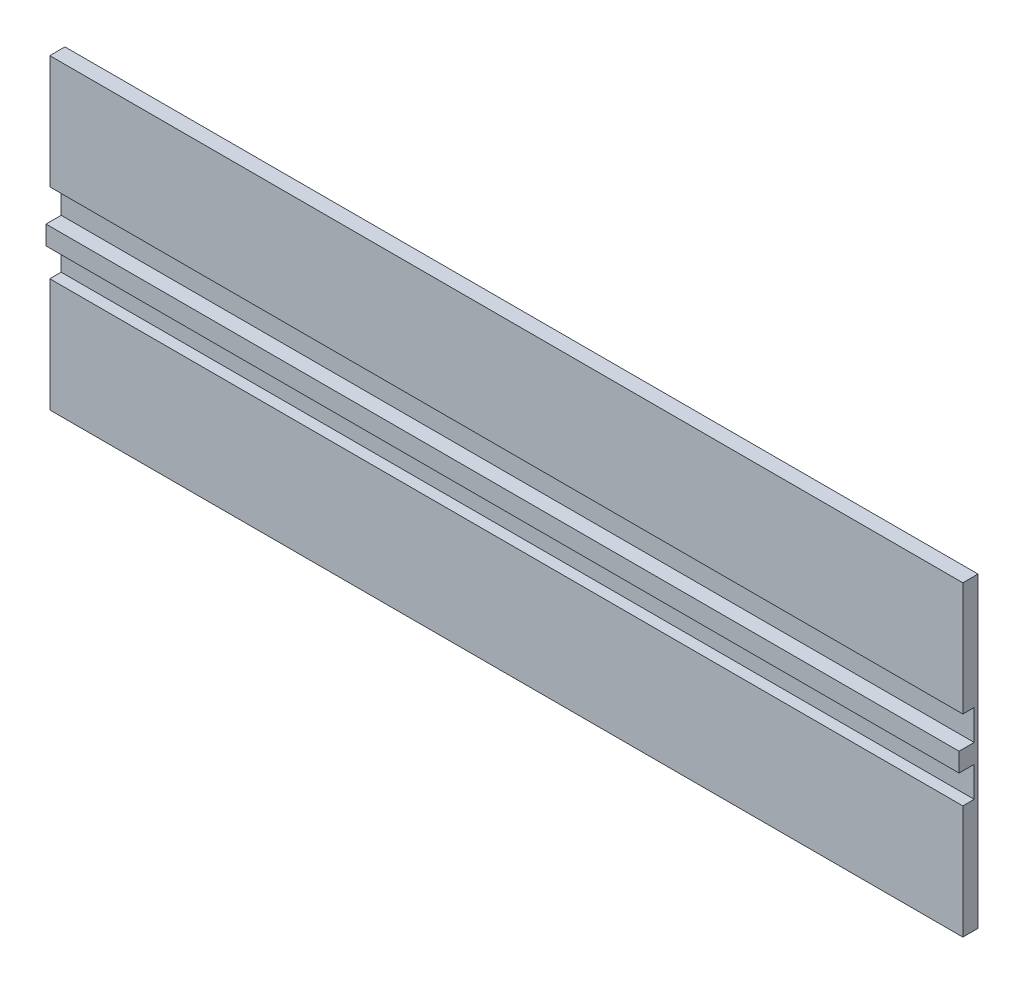
from build123d import *

# Parameters (mm, degrees)
SKIZZE1_W                       = 12050
SKIZZE1_H                       = 4050
AUFSATZ_LINEAR_AUSTRAGEN1_DEPTH = 200
SKIZZE2_W                       = 150
SKIZZE2_H                       = 1050
SCHNITT_LINEAR_AUSTRAGEN1_DEPTH = 12714.968695887
SKIZZE3_W                       = 200
SKIZZE3_H                       = 250
AUFSATZ_LINEAR_AUSTRAGEN2_DEPTH = 12050


with BuildPart() as part:
    # Skizze1 → Aufsatz-Linear austragen1 (new body)
    with BuildSketch(Plane.XY):
        with Locations((6025, 2025)):
            Rectangle(SKIZZE1_W, SKIZZE1_H)
    extrude(amount=AUFSATZ_LINEAR_AUSTRAGEN1_DEPTH)

    # Skizze2 → Schnitt-Linear austragen1 (cut, through all)
    with BuildSketch(Plane(origin=(12050, 0, 0), x_dir=(0, 0, -1), z_dir=(1, 0, 0))):
        with Locations((-125, 2025)):
            Rectangle(SKIZZE2_W, SKIZZE2_H)
    extrude(amount=-SCHNITT_LINEAR_AUSTRAGEN1_DEPTH, mode=Mode.SUBTRACT)

    # Skizze3 → Aufsatz-Linear austragen2 (add)
    with BuildSketch(Plane(origin=(12050, 0, 0), x_dir=(0, 0, -1), z_dir=(1, 0, 0))):
        with Locations((-150, 2025)):
            Rectangle(SKIZZE3_W, SKIZZE3_H)
    extrude(amount=-AUFSATZ_LINEAR_AUSTRAGEN2_DEPTH)


solid = part.part
